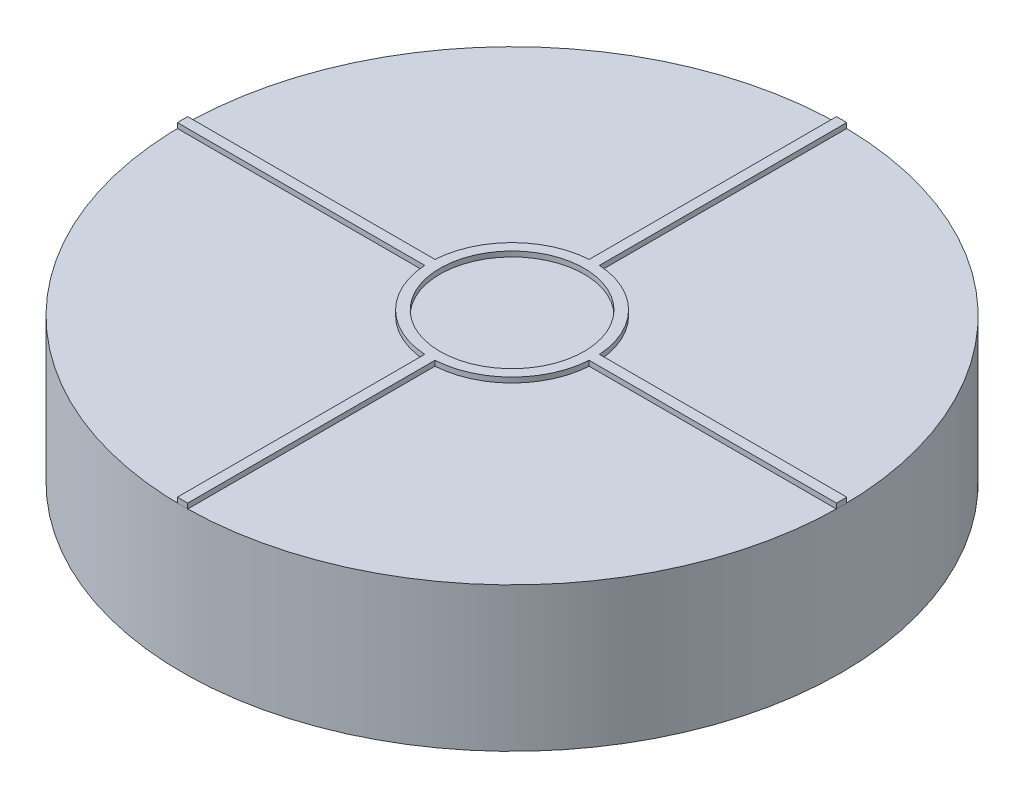
from build123d import *

# Parameters (mm, degrees)
SKETCH3_R           = 15
BOSS_EXTRUDE1_DEPTH = 4
SKETCH4_R           = 4
SKETCH4_R_2         = 3.5
BOSS_EXTRUDE2_DEPTH = 0.25


with BuildPart() as part:
    # Sketch2 → Revolve1 (revolve)
    with BuildSketch(Plane.XY, mode=Mode.PRIVATE) as revolve1_sk:
        Polygon((0, 0), (-16, 0), (-16, 7), (0, 7), (0, 6), (-15, 6), (-15, 1), (0, 1), align=None)
    revolve(revolve1_sk.sketch.rotate(Axis((0, 0, 0), (0, 1, 0)), 180), axis=Axis((0, 0, 0), (0, 1, 0)))


with BuildPart() as body_2:
    # Sketch3 → Boss-Extrude1 (new body)
    with BuildSketch(Plane(origin=(0, 1, 0), x_dir=(1, 0, 0), z_dir=(0, 1, 0))):
        with Locations(Location((0, 0, 0), (0, 0, 180))):
            Circle(SKETCH3_R)
    extrude(amount=BOSS_EXTRUDE1_DEPTH)

    # Sketch5 → Cut-Revolve1 (revolve, cut)
    with BuildSketch(Plane(origin=(0, 0, 0), x_dir=(0, 0, -1), z_dir=(1, 0, 0))):
        with BuildLine():
            Line((0, 7.5), (0, 1.5))
            ThreePointArc((0, 1.5), (-3, 4.5), (0, 7.5))
        make_face()
    revolve(axis=Axis((0, 7.5, 0), (0, -1, 0)), mode=Mode.SUBTRACT)


with BuildPart() as body_3:
    # Sketch4 → Boss-Extrude2 (new body)
    # profile 1 of 5: a face of its own
    with BuildSketch(Plane(origin=(0, 7, 0), x_dir=(1, 0, 0), z_dir=(0, 1, 0))):
        Circle(SKETCH4_R)
        with Locations(Location((0, 0, 0), (0, 0, 270))):
            Circle(SKETCH4_R_2, mode=Mode.SUBTRACT)
    # profile 2 of 5: a face of its own
    with BuildSketch(Plane(origin=(0, 7, 0), x_dir=(1, 0, 0), z_dir=(0, 1, 0))):
        with BuildLine():
            Line((3.992179856, -0.25), (15.998046756, -0.25))
            ThreePointArc((15.998046756, -0.25), (15.999511681, -0.125003815), (16, 0))
            ThreePointArc((16, 0), (15.999511681, 0.125003815), (15.998046756, 0.25))
            Line((15.998046756, 0.25), (3.992179856, 0.25))
            ThreePointArc((3.992179856, 0.25), (3.998044486, 0.12506114), (4, 0))
            ThreePointArc((4, 0), (3.998044486, -0.12506114), (3.992179856, -0.25))
        make_face()
    # profile 3 of 5: a face of its own
    with BuildSketch(Plane(origin=(0, 7, 0), x_dir=(1, 0, 0), z_dir=(0, 1, 0))):
        with BuildLine():
            ThreePointArc((0.25, 15.998046756), (0, 16), (-0.25, 15.998046756))
            Line((-0.25, 15.998046756), (-0.25, 3.992179856))
            ThreePointArc((-0.25, 3.992179856), (0, 4), (0.25, 3.992179856))
            Line((0.25, 3.992179856), (0.25, 15.998046756))
        make_face()
    # profile 4 of 5: a face of its own
    with BuildSketch(Plane(origin=(0, 7, 0), x_dir=(1, 0, 0), z_dir=(0, 1, 0))):
        with BuildLine():
            ThreePointArc((-15.998046756, 0.25), (-16, 0), (-15.998046756, -0.25))
            Line((-15.998046756, -0.25), (-3.992179856, -0.25))
            ThreePointArc((-3.992179856, -0.25), (-4, 0), (-3.992179856, 0.25))
            Line((-3.992179856, 0.25), (-15.998046756, 0.25))
        make_face()
    # profile 5 of 5: a face of its own
    with BuildSketch(Plane(origin=(0, 7, 0), x_dir=(1, 0, 0), z_dir=(0, 1, 0))):
        with BuildLine():
            Line((-0.25, -3.992179856), (-0.25, -15.998046756))
            ThreePointArc((-0.25, -15.998046756), (0, -16), (0.25, -15.998046756))
            Line((0.25, -15.998046756), (0.25, -3.992179856))
            ThreePointArc((0.25, -3.992179856), (0, -4), (-0.25, -3.992179856))
        make_face()
    extrude(amount=BOSS_EXTRUDE2_DEPTH)


solid = Compound([part.part, body_2.part, body_3.part])
